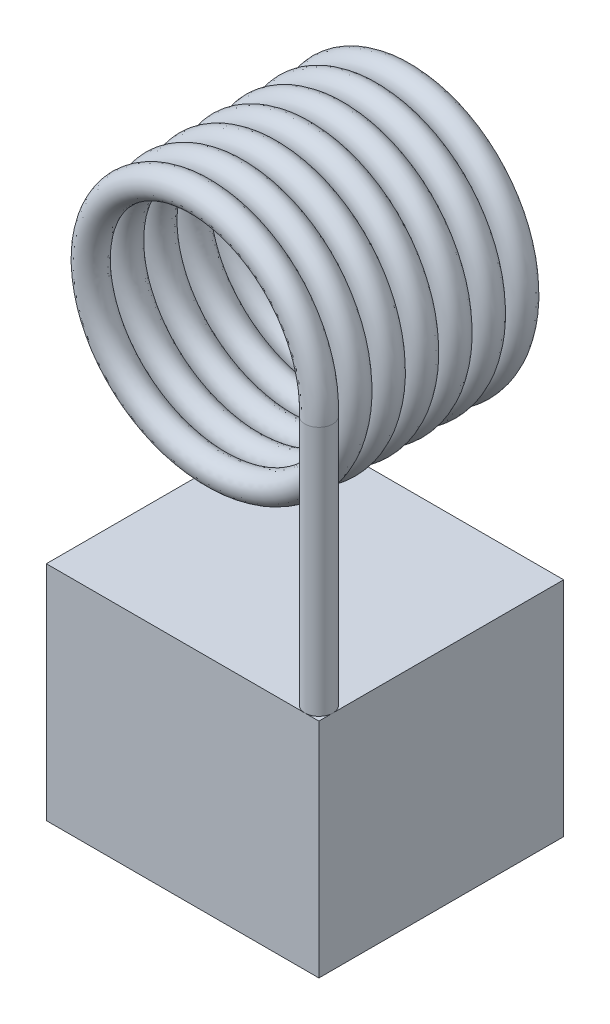
from build123d import *

# Parameters (mm, degrees)
SWEEP1_PITCH             = 15.24
SWEEP1_HEIGHT            = 99.06
SWEEP1_RADIUS            = 55.88
SWEEP1_START_ANGLE       = -180
SKETCH2_R                = 6.35
SKETCH3_R                = 6.35
BOSS_EXTRUDE1_DEPTH      = 152.4
BOSS_EXTRUDE2_DEPTH      = 63.5
BOSS_EXTRUDE2_DEPTH_BACK = 38.1
SKETCH4_W                = 124.46
SKETCH4_H                = 111.76


with BuildPart() as part:
    # Sweep1: sweep along a helix
    with BuildLine() as sweep1_path:
        add(Helix(SWEEP1_PITCH, SWEEP1_HEIGHT, SWEEP1_RADIUS, center=(0, 0, 0), direction=(0, 0, 1), lefthand=True, mode=Mode.PRIVATE).rotate(Axis((0, 0, 0), (0, 0, 1)), SWEEP1_START_ANGLE))
    # Sketch2 → Sweep1 (sweep)
    with BuildSketch(Plane(origin=(0, 0, 0), x_dir=(1, 0, 0), z_dir=(0, 1, 0))):
        with Locations((-55.88, 0)):
            Circle(SKETCH2_R)
    sweep(path=sweep1_path.line, is_frenet=True)

    # Sketch3 → Boss-Extrude1 (add)
    with BuildSketch(Plane.XZ):
        with Locations(Location((55.88, 99.06, 0), (0, 0, 180))):
            Circle(SKETCH3_R)
        with Locations(Location((-55.88, 0, 0), (0, 0, 180))):
            Circle(SKETCH3_R)
    extrude(amount=BOSS_EXTRUDE1_DEPTH)

    # Sketch4 → Boss-Extrude2 (add, two sides: drawn at the far end of the back side and taken through both)
    with BuildSketch(Plane.XZ.offset(152.4).offset(-BOSS_EXTRUDE2_DEPTH_BACK)):
        with Locations((0, 49.53)):
            Rectangle(SKETCH4_W, SKETCH4_H)
    extrude(amount=BOSS_EXTRUDE2_DEPTH + BOSS_EXTRUDE2_DEPTH_BACK)


solid = part.part
